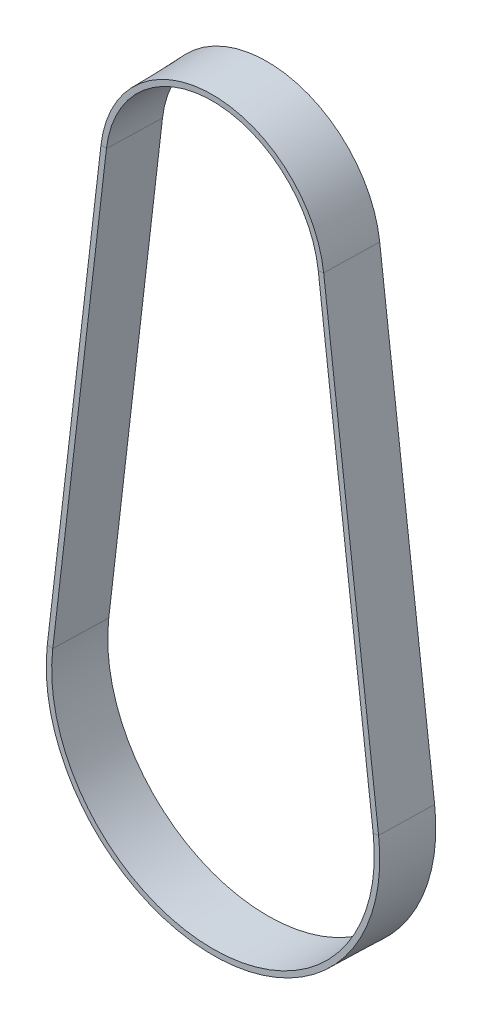
from build123d import *


with BuildPart() as part:
    # Sweep1: sweep along a path in Sketch2
    with BuildLine(Plane.XY) as sweep1_path:
        Line((19.858792416, 2.372417285), (29.901407752, -81.691298891))
        ThreePointArc((29.901407752, -81.691298891), (0.153061636, -115.249898361), (-29.684316712, -81.770433785))
        Line((-29.684316712, -81.770433785), (-19.865023893, 2.319660689))
        ThreePointArc((-19.865023893, 2.319660689), (-0.026561672, 19.999982362), (19.858792416, 2.372417285))
    # Sketch3 → Sweep1 (sweep)
    with BuildSketch(Plane(origin=(19.858792416, 2.372417285, 0), x_dir=(-0.9929396208069757, -0.11862086423433003, 0), z_dir=(0.11862086423433002, -0.9929396208069756, 0))):
        Polygon((0.75, 10), (-0.75, 10), (-0.5, 0), (0.5, 0), align=None)
    sweep(path=sweep1_path.line)


solid = part.part
